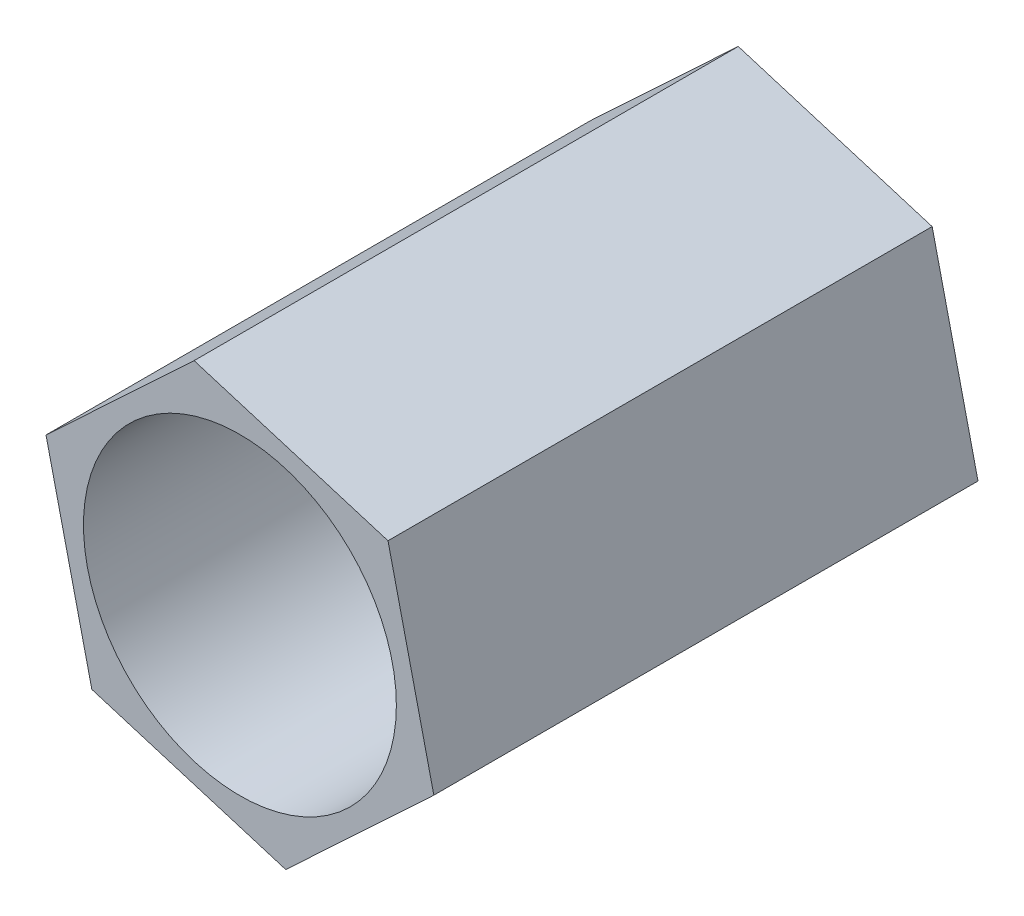
from build123d import *

# Parameters (mm, degrees)
SKETCH1_R           = 2.875
BOSS_EXTRUDE1_DEPTH = 10


with BuildPart() as part:
    # Sketch1 → Boss-Extrude1 (new body)
    with BuildSketch(Plane.XY):
        Polygon((-2.721196162, -2.543760297), (0.842362957, -3.628505153), (3.563559119, -1.084744856), (2.721196162, 2.543760297), (-0.842362957, 3.628505153), (-3.563559119, 1.084744856), align=None)
        Circle(SKETCH1_R, mode=Mode.SUBTRACT)
    extrude(amount=BOSS_EXTRUDE1_DEPTH)


solid = part.part
